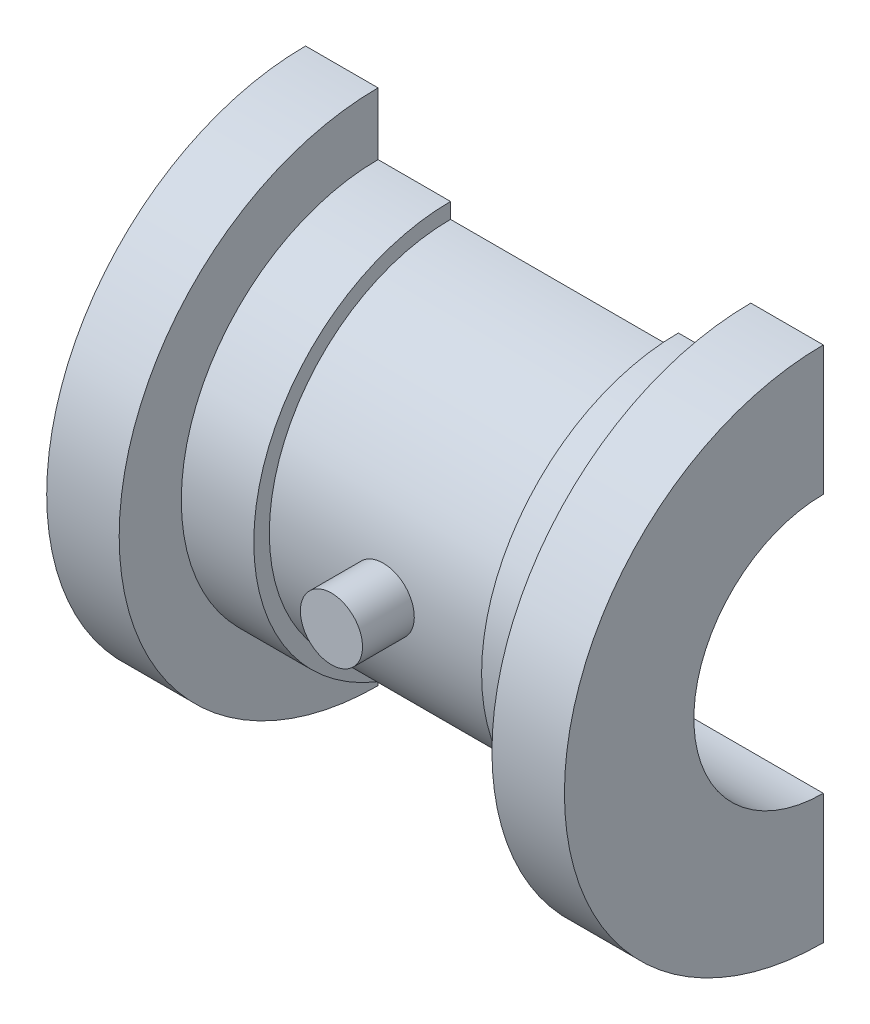
from build123d import *

# Parameters (mm, degrees)
REVOLVE1_ANGLE      = 180
CUT_EXTRUDE3_DEPTH  = 50
SKETCH4_R           = 3
BOSS_EXTRUDE1_DEPTH = 5


with BuildPart() as part:
    # Sketch1 → Revolve1 (revolve)
    with BuildSketch(Plane.XY):
        Polygon((25, 0), (-25, 0), (-25, 25), (-18, 25), (-18, 19), (-11, 19), (-11, 17.5), (11, 17.5), (11, 19), (18, 19), (18, 25), (25, 25), align=None)
    revolve(axis=Axis((-38.949360705, 0, 0), (1, 0, 0)), revolution_arc=REVOLVE1_ANGLE)

    # Sketch2 → Cut-Extrude3 (cut)
    with BuildSketch(Plane.ZY.offset(25)):
        with BuildLine():
            Line((0, 12.5), (0, -12.5))
            ThreePointArc((0, -12.5), (12.5, 0), (0, 12.5))
        make_face()
    extrude(amount=-CUT_EXTRUDE3_DEPTH, mode=Mode.SUBTRACT)


with BuildPart() as body_2:
    # Sketch4 → Boss-Extrude1 (new body)
    with BuildSketch(Plane(origin=(0, 0, 17.5), x_dir=(-1, 0, 0), z_dir=(0, 0, -1))):
        with Locations(Location((0, 0, 0), (0, 0, 90))):
            Circle(SKETCH4_R)
    extrude(amount=-BOSS_EXTRUDE1_DEPTH)


solid = Compound([part.part, body_2.part])
